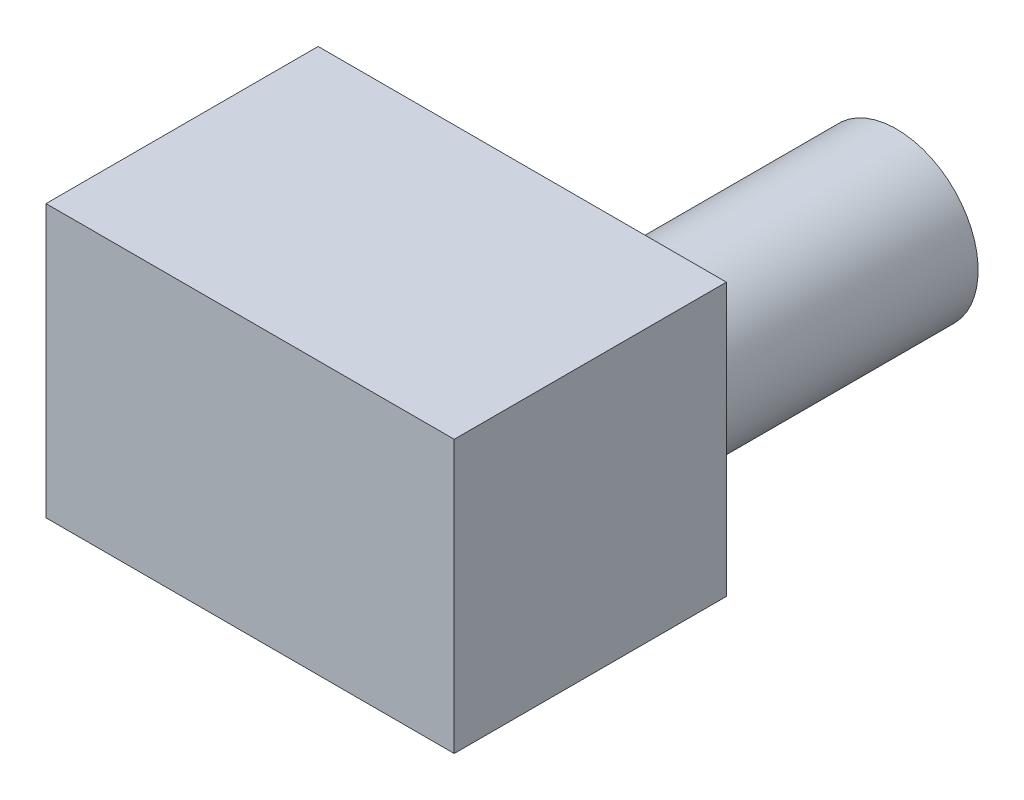
from build123d import *

# Parameters (mm, degrees)
SKIZZE1_W                       = 7.5
SKIZZE1_H                       = 5
AUFSATZ_LINEAR_AUSTRAGEN1_DEPTH = 5
AUFSATZ_LINEAR_AUSTRAGEN2_DEPTH = 5


with BuildPart() as part:
    # Skizze1 → Aufsatz-Linear austragen1 (new body)
    with BuildSketch(Plane.XY):
        Rectangle(SKIZZE1_W, SKIZZE1_H)
    extrude(amount=AUFSATZ_LINEAR_AUSTRAGEN1_DEPTH)

    # Skizze2 → Aufsatz-Linear austragen2 (add)
    with BuildSketch(Plane(origin=(0, 0, 0), x_dir=(-1, 0, 0), z_dir=(0, 0, -1))):
        with BuildLine():
            ThreePointArc((-0.375, 0), (-1.875, 1.5), (-3.375, 0))
            Line((-3.375, 0), (-0.375, 0))
        make_face()
        with BuildLine():
            Line((-0.375, 0), (-3.375, 0))
            ThreePointArc((-3.375, 0), (-1.875, -1.5), (-0.375, 0))
        make_face()
    extrude(amount=AUFSATZ_LINEAR_AUSTRAGEN2_DEPTH)


solid = part.part
